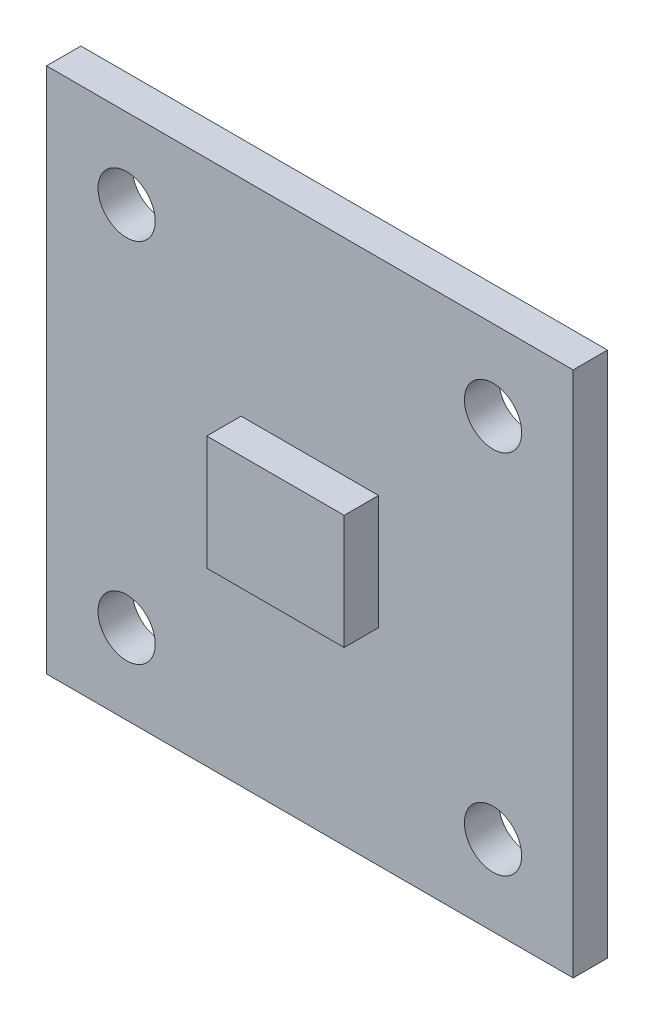
from build123d import *

# Parameters (mm, degrees)
SKETCH_1_W      = 23
SKETCH_1_H      = 23
SKETCH_1_R      = 1.25
EXTRUDE_1_DEPTH = 0.75
SKETCH_2_W      = 6
SKETCH_2_H      = 5
EXTRUDE_2_DEPTH = 1.5


with BuildPart() as part:
    # 草图1 → 凸台-拉伸1 (new, symmetric)
    with BuildSketch(Plane.XY):
        Rectangle(SKETCH_1_W, SKETCH_1_H)
        with Locations((-8, 8)):
            Circle(SKETCH_1_R, mode=Mode.SUBTRACT)
        with Locations((8, 8)):
            Circle(SKETCH_1_R, mode=Mode.SUBTRACT)
        with Locations((8, -8)):
            Circle(SKETCH_1_R, mode=Mode.SUBTRACT)
        with Locations((-8, -8)):
            Circle(SKETCH_1_R, mode=Mode.SUBTRACT)
    extrude(amount=EXTRUDE_1_DEPTH, both=True)

    # 草图2 → 凸台-拉伸2 (add)
    with BuildSketch(Plane.XY.offset(0.75)):
        Rectangle(SKETCH_2_W, SKETCH_2_H)
    extrude(amount=EXTRUDE_2_DEPTH)


solid = part.part
